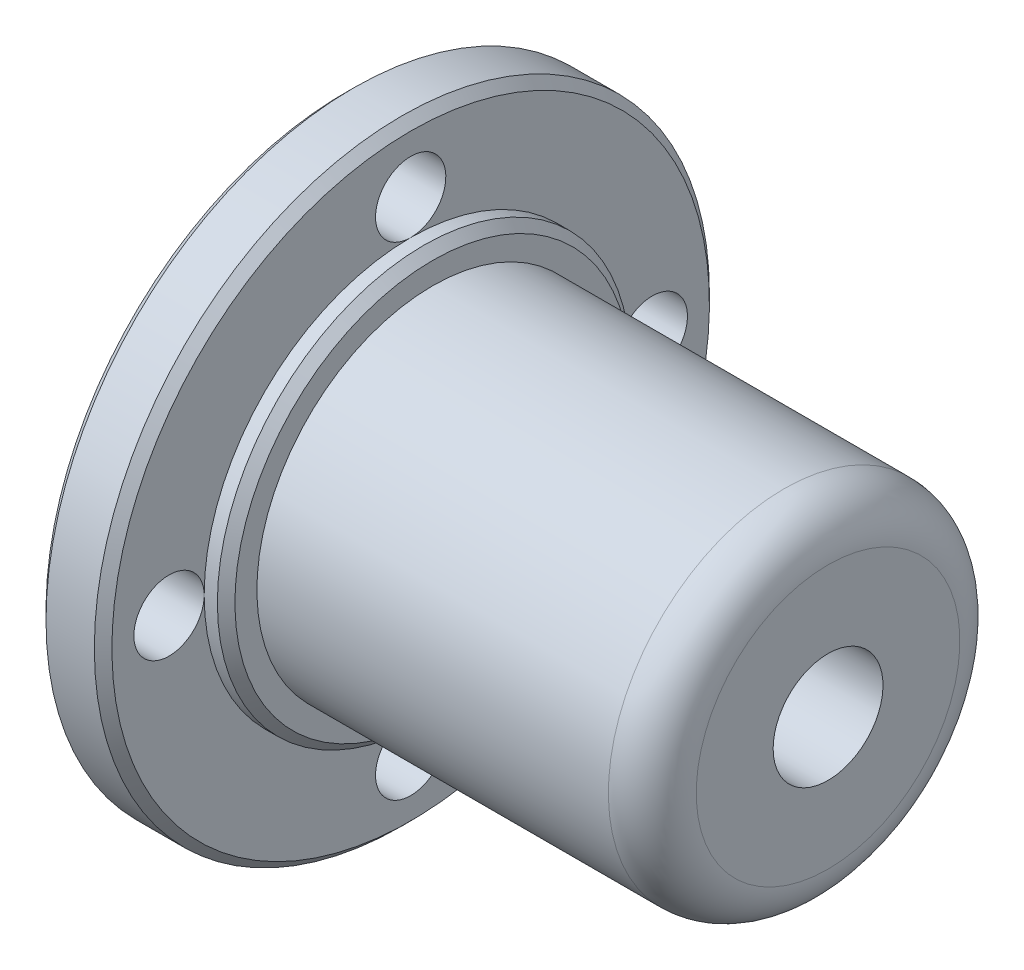
from build123d import *

# Parameters (mm, degrees)
HOLE_WIZARD_M3_1_D       = 2.5
FILLET_1_R               = 1
CHAMFER_1_SIZE           = 0.2
HOLE_WIZARD_M2_1_D       = 1.6
PATTERN_CIRCULAR_1_COUNT = 4
CHAMFER_2_SIZE           = 0.2


with BuildPart() as part:
    # 草图1 → 旋转1 (revolve)
    with BuildSketch(Plane.XY):
        Polygon((11, 0), (6, 0), (6, 2.5), (1, 2.5), (1, 4), (0, 4), (0, 7), (1.5, 7), (1.5, 4.7), (2, 4.7), (2, 4), (11, 4), align=None)
    revolve(axis=Axis((11, 0, 0), (-1, 0, 0)))

    # M3 螺纹孔1 (through all)
    with Locations(Plane.ZY.offset(-6)):
        with Locations((0, 0)):
            Hole(HOLE_WIZARD_M3_1_D / 2)

    # 圆角1
    fillet_1_edges = [part.edges().sort_by_distance(p)[0] for p in [
        (11, -4, 0),
    ]]
    fillet(fillet_1_edges, radius=FILLET_1_R)

    # 倒角1
    chamfer_1_edges = [part.edges().sort_by_distance(p)[0] for p in [
        (1.5, -7, 0),
        (0, -7, 0),
        (0, -4, 0),
        (1, -2.5, 0),
    ]]
    chamfer(chamfer_1_edges, length=CHAMFER_1_SIZE)

    # M2 螺纹孔1 (through all)
    with Locations(Plane.ZY):
        with Locations((0, -5.5)):
            hole_wizard_m2_1 = Hole(HOLE_WIZARD_M2_1_D / 2)

    # 阵列(圆周)1: M2 螺纹孔1 ×4 about axis
    pattern_circular_1_axis = Axis((0, 0, 0), (1, 0, 0))
    for i in range(1, PATTERN_CIRCULAR_1_COUNT):
        add(hole_wizard_m2_1.rotate(pattern_circular_1_axis, i * 360 / PATTERN_CIRCULAR_1_COUNT), mode=Mode.SUBTRACT)

    # 倒角2
    chamfer_2_edges = [part.edges().sort_by_distance(p)[0] for p in [
        (2, -4.7, 0),
    ]]
    chamfer(chamfer_2_edges, length=CHAMFER_2_SIZE)


solid = part.part
